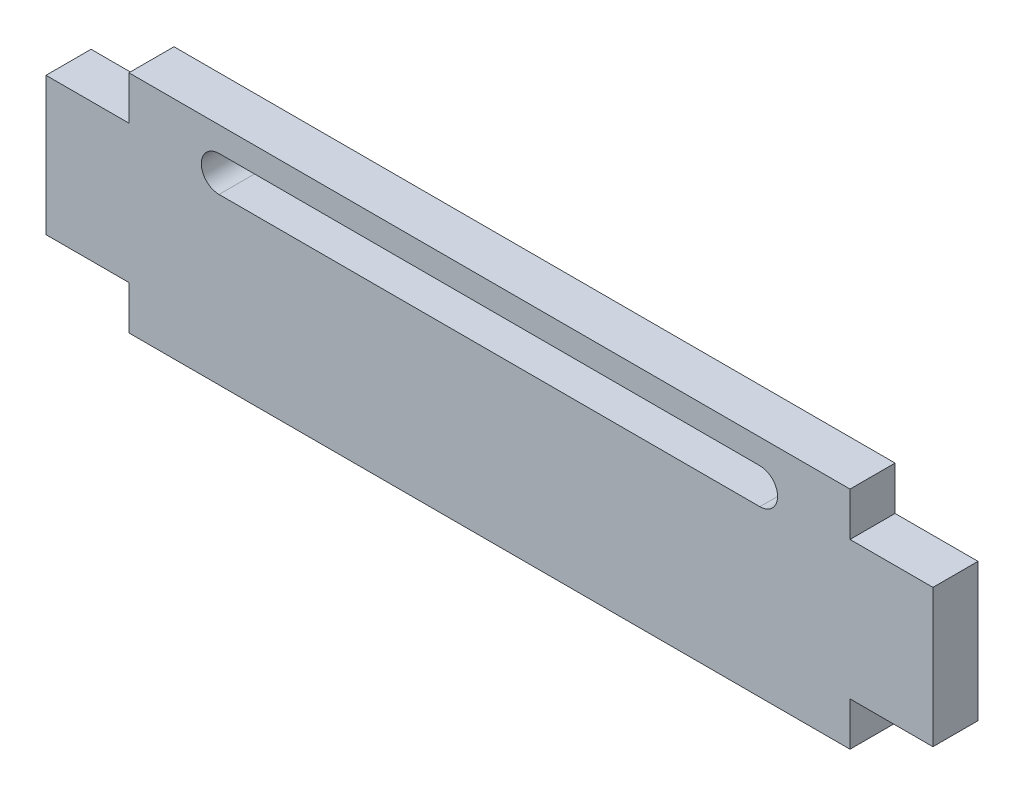
from build123d import *

# Parameters (mm, degrees)
BOSS_EXTRUDE1_DEPTH = 3.175


with BuildPart() as part:
    # Sketch1 → Boss-Extrude1 (new body)
    with BuildSketch(Plane.XY):
        Polygon((-25.4, -7.9375), (25.4, -7.9375), (25.4, -4.8625), (31.242, -4.8625), (31.242, 4.8625), (25.4, 4.8625), (25.4, 7.9375), (-25.4, 7.9375), (-25.4, 4.8625), (-31.242, 4.8625), (-31.242, -4.8625), (-25.4, -4.8625), align=None)
        with BuildLine():
            Line((-19.05, 6.1875), (19.05, 6.1875))
            ThreePointArc((19.05, 6.1875), (20.3, 4.9375), (19.05, 3.6875))
            Line((19.05, 3.6875), (-19.05, 3.6875))
            ThreePointArc((-19.05, 3.6875), (-20.3, 4.9375), (-19.05, 6.1875))
        make_face(mode=Mode.SUBTRACT)
    extrude(amount=BOSS_EXTRUDE1_DEPTH)


solid = part.part
